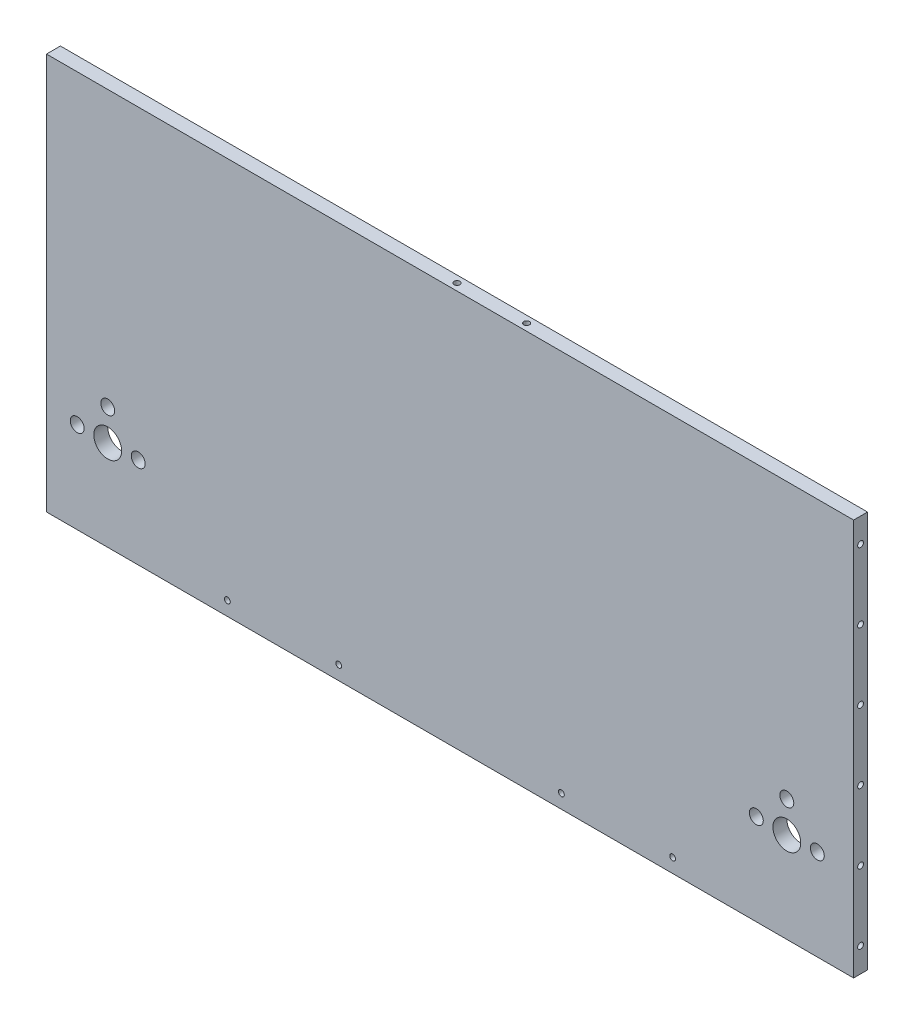
from build123d import *

# Parameters (mm, degrees)
SKETCH_1_W                  = 580
SKETCH_1_H                  = 285
EXTRUDE_1_DEPTH             = 10
HOLE_WIZARD_M5_1_AT_2_COUNT = 2
HOLE_WIZARD_M5_1_AT_2_PITCH = 50
HOLE_WIZARD_M5_1_AT_3_COUNT = 2
HOLE_WIZARD_M5_1_AT_3_PITCH = 100
HOLE_WIZARD_M5_1_AT_4_COUNT = 2
HOLE_WIZARD_M5_1_AT_4_PITCH = 150
HOLE_WIZARD_M5_1_AT_5_COUNT = 2
HOLE_WIZARD_M5_1_AT_5_PITCH = 200
HOLE_WIZARD_M5_1_AT_6_COUNT = 2
HOLE_WIZARD_M5_1_AT_6_PITCH = 250
HOLE_WIZARD_M5_2_D          = 4.2
HOLE_WIZARD_M5_3_D          = 4.2
SKETCH_12_R                 = 5
CUT_EXTRUDE_1_DEPTH         = 324.274264364
SKETCH_12_4_R               = 10
CUT_EXTRUDE_2_DEPTH         = 324.274264364


with BuildPart() as part:
    # 草图1 → 凸台-拉伸1 (new body)
    with BuildSketch(Plane.XY):
        Rectangle(SKETCH_1_W, SKETCH_1_H)
    extrude(amount=EXTRUDE_1_DEPTH)

    # 草图5 → M5 螺纹孔1 (revolve, cut)
    with BuildSketch(Plane(origin=(-290, 125, 5), x_dir=(0, 0, 1), z_dir=(0, 1, 0))):
        Polygon((0, 0), (0, 15.2618073), (2.1, 14), (2.1, 0), align=None)
    hole_wizard_m5_1 = revolve(axis=Axis((-296.35, 125, 5), (1, 0, 0)), mode=Mode.SUBTRACT)

    # M5 螺纹孔1 at 2: M5 螺纹孔1 ×2
    with Locations(*[(0, -i * HOLE_WIZARD_M5_1_AT_2_PITCH, 0) for i in range(1, HOLE_WIZARD_M5_1_AT_2_COUNT)]):
        add(hole_wizard_m5_1, mode=Mode.SUBTRACT)

    # M5 螺纹孔1 at 3: M5 螺纹孔1 ×2
    with Locations(*[(0, -i * HOLE_WIZARD_M5_1_AT_3_PITCH, 0) for i in range(1, HOLE_WIZARD_M5_1_AT_3_COUNT)]):
        add(hole_wizard_m5_1, mode=Mode.SUBTRACT)

    # M5 螺纹孔1 at 4: M5 螺纹孔1 ×2
    with Locations(*[(0, -i * HOLE_WIZARD_M5_1_AT_4_PITCH, 0) for i in range(1, HOLE_WIZARD_M5_1_AT_4_COUNT)]):
        add(hole_wizard_m5_1, mode=Mode.SUBTRACT)

    # M5 螺纹孔1 at 5: M5 螺纹孔1 ×2
    with Locations(*[(0, -i * HOLE_WIZARD_M5_1_AT_5_PITCH, 0) for i in range(1, HOLE_WIZARD_M5_1_AT_5_COUNT)]):
        add(hole_wizard_m5_1, mode=Mode.SUBTRACT)

    # M5 螺纹孔1 at 6: M5 螺纹孔1 ×2
    with Locations(*[(0, -i * HOLE_WIZARD_M5_1_AT_6_PITCH, 0) for i in range(1, HOLE_WIZARD_M5_1_AT_6_COUNT)]):
        add(hole_wizard_m5_1, mode=Mode.SUBTRACT)

    # 镜向1: M5 螺纹孔1 across plane
    add(hole_wizard_m5_1.mirror(Plane(origin=(0, 0, 0), x_dir=(0, 0, 1), z_dir=(1, 0, 0))), mode=Mode.SUBTRACT)

    # 镜向1 copy 1 sketch → 镜向1 copy 1 (revolve, cut)
    with BuildSketch(Plane(origin=(290, 75, 5), x_dir=(0, 0, 1), z_dir=(0, 1, 0))):
        Polygon((0, 0), (0, -15.2618073), (2.1, -14), (2.1, 0), align=None)
    revolve(axis=Axis((296.35, 75, 5), (1, 0, 0)), mode=Mode.SUBTRACT)

    # 镜向1 copy 2 sketch → 镜向1 copy 2 (revolve, cut)
    with BuildSketch(Plane(origin=(290, 25, 5), x_dir=(0, 0, 1), z_dir=(0, 1, 0))):
        Polygon((0, 0), (0, -15.2618073), (2.1, -14), (2.1, 0), align=None)
    revolve(axis=Axis((296.35, 25, 5), (1, 0, 0)), mode=Mode.SUBTRACT)

    # 镜向1 copy 3 sketch → 镜向1 copy 3 (revolve, cut)
    with BuildSketch(Plane(origin=(290, -25, 5), x_dir=(0, 0, 1), z_dir=(0, 1, 0))):
        Polygon((0, 0), (0, -15.2618073), (2.1, -14), (2.1, 0), align=None)
    revolve(axis=Axis((296.35, -25, 5), (1, 0, 0)), mode=Mode.SUBTRACT)

    # 镜向1 copy 4 sketch → 镜向1 copy 4 (revolve, cut)
    with BuildSketch(Plane(origin=(290, -75, 5), x_dir=(0, 0, 1), z_dir=(0, 1, 0))):
        Polygon((0, 0), (0, -15.2618073), (2.1, -14), (2.1, 0), align=None)
    revolve(axis=Axis((296.35, -75, 5), (1, 0, 0)), mode=Mode.SUBTRACT)

    # 镜向1 copy 5 sketch → 镜向1 copy 5 (revolve, cut)
    with BuildSketch(Plane(origin=(290, -125, 5), x_dir=(0, 0, 1), z_dir=(0, 1, 0))):
        Polygon((0, 0), (0, -15.2618073), (2.1, -14), (2.1, 0), align=None)
    revolve(axis=Axis((296.35, -125, 5), (1, 0, 0)), mode=Mode.SUBTRACT)

    # M5 螺纹孔2 (through all)
    with Locations(Plane(origin=(0, -142.5, 0), x_dir=(-1, 0, 0), z_dir=(0, -1, 0))):
        with Locations((0, -5), (-50, -5)):
            Hole(HOLE_WIZARD_M5_2_D / 2)

    # M5 螺纹孔3 (through all)
    with Locations(Plane.XY.offset(10)):
        with Locations((-160, -132.5), (-80, -132.5), (80, -132.5), (160, -132.5)):
            Hole(HOLE_WIZARD_M5_3_D / 2)

    # 草图12 → 切除-拉伸1 (cut, through all)
    with BuildSketch(Plane.XY.offset(10)):
        with Locations((-246, -55.15)):
            Circle(SKETCH_12_R)
        with Locations((-267.92, -77.07)):
            Circle(SKETCH_12_R)
        with Locations((-224.08, -77.07)):
            Circle(SKETCH_12_R)
    cut_extrude_1 = extrude(amount=-CUT_EXTRUDE_1_DEPTH, mode=Mode.SUBTRACT)

    # 镜向2: 切除-拉伸1 across plane
    add(cut_extrude_1.mirror(Plane(origin=(-2, 0, 0), x_dir=(0, 0, 1), z_dir=(1, 0, 0))), mode=Mode.SUBTRACT)

    # 草图12<4> → 切除-拉伸2 (cut, through all)
    with BuildSketch(Plane.XY.offset(10)):
        with Locations((-246, -77.5)):
            Circle(SKETCH_12_4_R)
    cut_extrude_2 = extrude(amount=-CUT_EXTRUDE_2_DEPTH, mode=Mode.SUBTRACT)

    # 镜向3: 切除-拉伸2 across plane
    add(cut_extrude_2.mirror(Plane(origin=(-2, 0, 0), x_dir=(0, 0, 1), z_dir=(1, 0, 0))), mode=Mode.SUBTRACT)


solid = part.part
